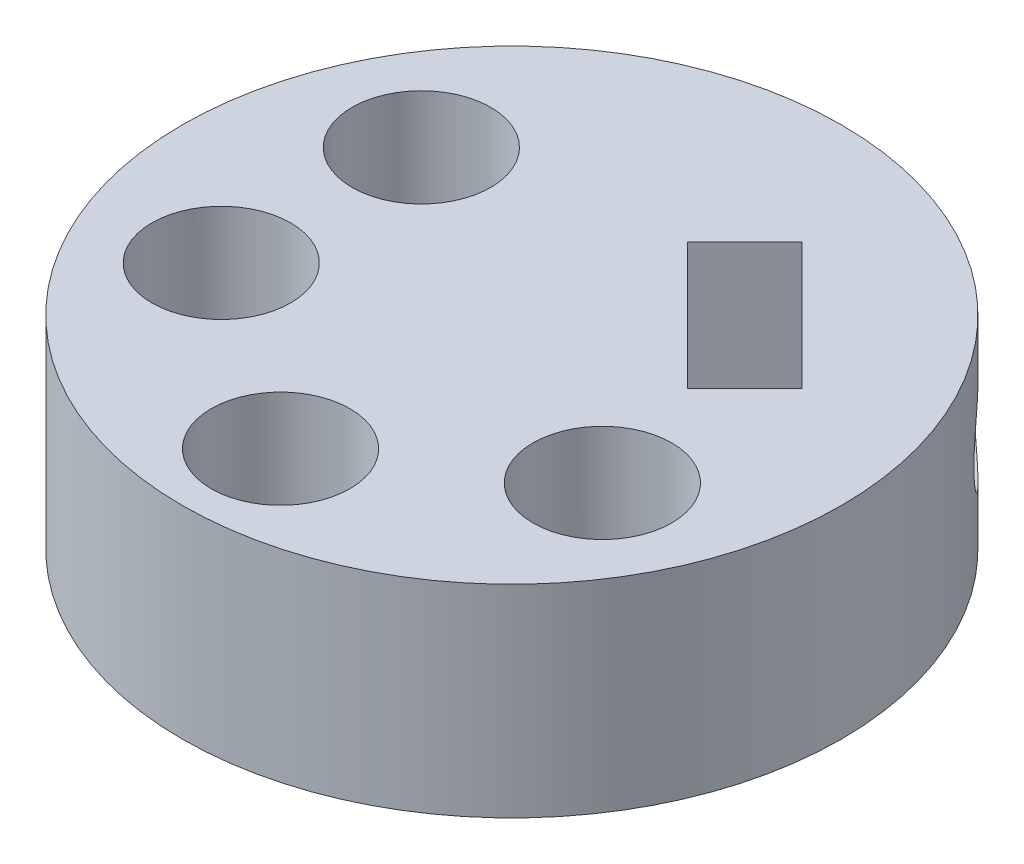
from build123d import *

# Parameters (mm, degrees)
ESBO_O2_R                         = 11.4
RESSALTO_EXTRUS_O3_DEPTH          = 7
ESBO_O1_R                         = 2.4
CORTE_EXTRUS_O4_DEPTH             = 15
ESBO_O6_R                         = 3.9
RESSALTO_EXTRUS_O5_DEPTH          = 2
CORTE_EXTRUS_O7_DEPTH             = 4
CORTE_EXTRUS_O7_DEPTH_BACK        = 6
ESBO_O4_R                         = 2
CORTE_EXTRUS_O8_DEPTH             = 10.5
CORTE_EXTRUS_O9_REACH             = 23.588
ESBO_O8_R                         = 1.5
CORTE_EXTRUS_O9_DIRECTION_2_DEPTH = 22.588411189


with BuildPart() as part:
    # Esboço2 → Ressalto-extrusão3 (new body)
    with BuildSketch(Plane(origin=(0, 0, 0), x_dir=(1, 0, 0), z_dir=(0, 1, 0))):
        with Locations(Location((0, 0, 0), (0, 0, 270))):
            Circle(ESBO_O2_R)
    extrude(amount=RESSALTO_EXTRUS_O3_DEPTH)

    # Esboço1 → Corte-extrusão4 (cut)
    with BuildSketch(Plane(origin=(0, 0, 0), x_dir=(1, 0, 0), z_dir=(0, 1, 0))):
        with Locations(Location((-6.59, 3.46, 0), (0, 0, 270))):
            Circle(ESBO_O1_R)
        with Locations(Location((6.59, -3.46, 0), (0, 0, 90))):
            Circle(ESBO_O1_R)
        with Locations(Location((0, -8, 0), (0, 0, 90))):
            Circle(ESBO_O1_R)
        with Locations(Location((-6.59, -3.46, 0), (0, 0, 90))):
            Circle(ESBO_O1_R)
    extrude(amount=CORTE_EXTRUS_O4_DEPTH, mode=Mode.SUBTRACT)

    # Esboço6 → Ressalto-extrusão5 (add)
    with BuildSketch(Plane.XZ):
        with Locations(Location((0, 0, 0), (0, 0, 90))):
            Circle(ESBO_O6_R)
    extrude(amount=RESSALTO_EXTRUS_O5_DEPTH)

    # Esboço4 → Corte-extrusão7 (cut, two sides: drawn at the far end of the back side and taken through both)
    with BuildSketch(Plane(origin=(0, 0, 0), x_dir=(-1, 0, 0), z_dir=(0, -1, 0)).offset(-CORTE_EXTRUS_O7_DEPTH_BACK)):
        with Locations(Location((0, 0, 0), (0, 0, 90))):
            Circle(ESBO_O4_R)
    extrude(amount=CORTE_EXTRUS_O7_DEPTH + CORTE_EXTRUS_O7_DEPTH_BACK, mode=Mode.SUBTRACT)

    # Esboço7 → Corte-extrusão8 (cut)
    with BuildSketch(Plane.XZ):
        Polygon((7.212489168, -2.828427125), (2.828427125, -7.212489168), (0.848528137, -5.232590181), (3.040559159, -3.040559159), (5.232590181, -0.848528137), align=None)
    extrude(amount=-CORTE_EXTRUS_O8_DEPTH, mode=Mode.SUBTRACT)

    # Esboço8 → Corte-extrusão9 (cut, up to next)
    with BuildSketch(Plane(origin=(3.040559159, 0, -3.040559159), x_dir=(-0.7071067811865475, 0, -0.7071067811865477), z_dir=(0.7071067811865477, 0, -0.7071067811865475)), mode=Mode.PRIVATE) as corte_extrus_o9_sk1:
        with Locations((0, 3.5)):
            Circle(ESBO_O8_R)
    corte_extrus_o9_tool1 = extrude(corte_extrus_o9_sk1.sketch, amount=-CORTE_EXTRUS_O9_REACH, mode=Mode.PRIVATE) & part.part
    add(corte_extrus_o9_tool1.solids().sort_by_distance((3.040559, 3.5, -3.040559))[0], mode=Mode.SUBTRACT)

    # Esboço8 → Corte-extrusão9 direction 2 (cut)
    with BuildSketch(Plane(origin=(3.040559159, 0, -3.040559159), x_dir=(-0.7071067811865475, 0, -0.7071067811865477), z_dir=(0.7071067811865477, 0, -0.7071067811865475))):
        with Locations((0, 3.5)):
            Circle(ESBO_O8_R)
    extrude(amount=CORTE_EXTRUS_O9_DIRECTION_2_DEPTH, mode=Mode.SUBTRACT)


solid = part.part
